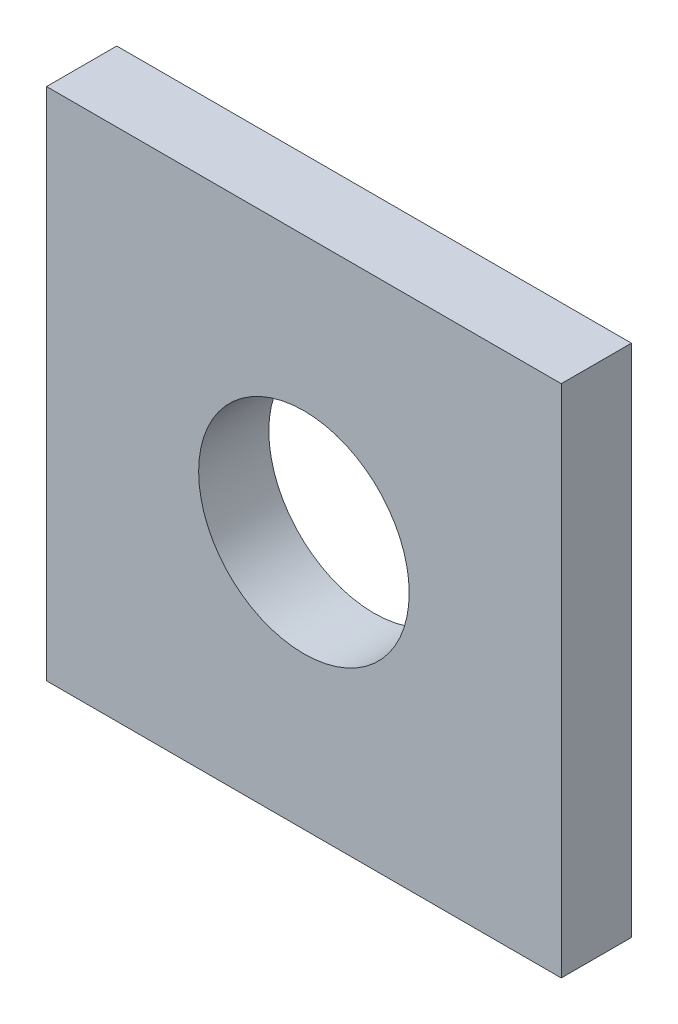
from build123d import *

# Parameters (mm, degrees)
SKETCH1_W           = 22
SKETCH1_H           = 22
SKETCH1_R           = 4.5
BOSS_EXTRUDE1_DEPTH = 3


with BuildPart() as part:
    # Sketch1 → Boss-Extrude1 (new body)
    with BuildSketch(Plane.XY):
        with Locations((11, 11)):
            Rectangle(SKETCH1_W, SKETCH1_H)
        with Locations((11, 11)):
            Circle(SKETCH1_R, mode=Mode.SUBTRACT)
    extrude(amount=BOSS_EXTRUDE1_DEPTH)


solid = part.part
